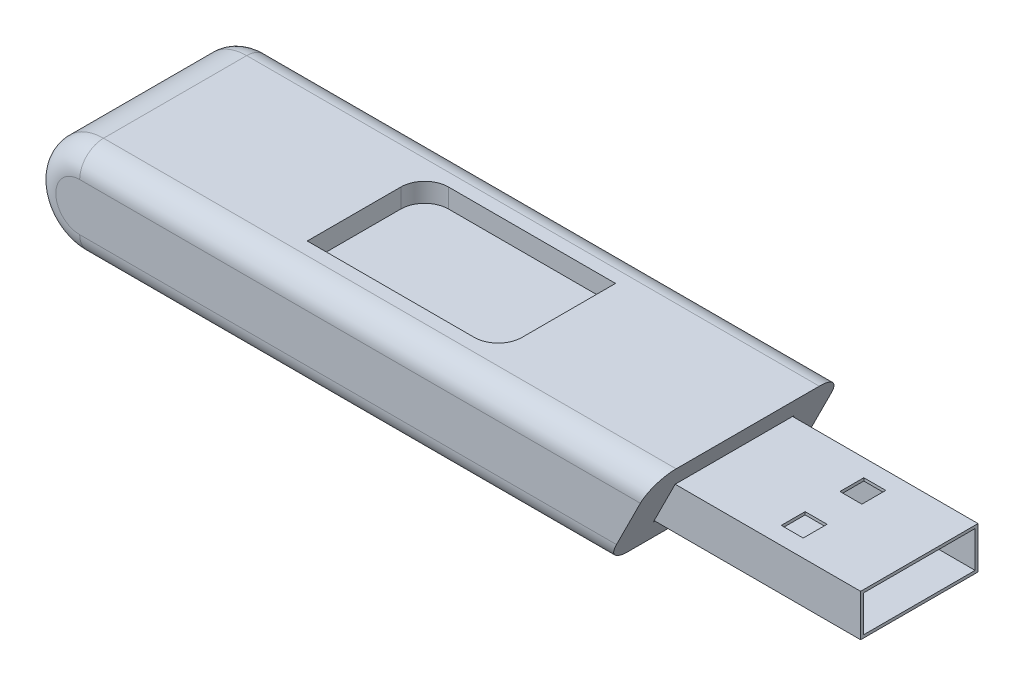
from build123d import *

# Parameters (mm, degrees)
BOSS_EXTRUDE1_DEPTH = 20
SKETCH2_W           = 12.5
SKETCH2_H           = 4.6
CUT_EXTRUDE1_DEPTH  = 60
SKETCH4_W           = 12.3
SKETCH4_H           = 4.4
SKETCH4_W_2         = 11.7
SKETCH4_H_2         = 3.8
BOSS_EXTRUDE3_DEPTH = 40
SKETCH6_W           = 2.3
SKETCH6_H           = 2.5
CUT_EXTRUDE8_DEPTH  = 0.3
CUT_EXTRUDE10_DEPTH = 2
FILLET1_R           = 2.5
FILLET2_R           = 2.5


with BuildPart() as part:
    # Sketch1 → Boss-Extrude1 (new body)
    with BuildSketch(Plane.XY):
        with BuildLine():
            Line((-27.982882883, 10), (32.017117117, 10))
            Line((32.017117117, 10), (27.017117117, 0))
            Line((27.017117117, 0), (-27.982882883, 0))
            ThreePointArc((-27.982882883, 0), (-32.982882883, 5), (-27.982882883, 10))
        make_face()
    extrude(amount=BOSS_EXTRUDE1_DEPTH)

    # Sketch2 → Cut-Extrude1 (cut)
    with BuildSketch(Plane(origin=(50, 0, 0), x_dir=(0, 0, -1), z_dir=(1, 0, 0))):
        with Locations((-10, 5)):
            Rectangle(SKETCH2_W, SKETCH2_H)
    extrude(amount=-CUT_EXTRUDE1_DEPTH, mode=Mode.SUBTRACT)

    # Sketch7 → Cut-Extrude10 (cut)
    with BuildSketch(Plane(origin=(0, 10, 0), x_dir=(1, 0, 0), z_dir=(0, 1, 0))):
        with BuildLine():
            Line((-5.482882883, -3.85), (12.017117117, -3.85))
            Line((12.017117117, -3.85), (12.017117117, -13.65))
            ThreePointArc((12.017117117, -13.65), (11.28488407, -15.417766953), (9.517117117, -16.15))
            Line((9.517117117, -16.15), (-7.982882883, -16.15))
            Line((-7.982882883, -16.15), (-7.982882883, -6.35))
            ThreePointArc((-7.982882883, -6.35), (-7.250649836, -4.582233047), (-5.482882883, -3.85))
        make_face()
    extrude(amount=-CUT_EXTRUDE10_DEPTH, mode=Mode.SUBTRACT)

    # Fillet1
    fillet1_edges = [part.edges().sort_by_distance(p)[0] for p in [
        (2.017117117, 10, 20),
        (-32.982882883, 5, 20),
        (-0.482882883, 0, 20),
    ]]
    fillet(fillet1_edges, radius=FILLET1_R)

    # Fillet2
    fillet2_edges = [part.edges().sort_by_distance(p)[0] for p in [
        (2.017117117, 10, 0),
        (-0.482882883, 0, 0),
        (-32.982882883, 5, 0),
    ]]
    fillet(fillet2_edges, radius=FILLET2_R)


with BuildPart() as body_2:
    # Sketch4 → Boss-Extrude3 (new body)
    with BuildSketch(Plane(origin=(50, 0, 0), x_dir=(0, 0, -1), z_dir=(1, 0, 0))):
        with Locations((-10, 5)):
            Rectangle(SKETCH4_W, SKETCH4_H)
        with Locations((-10, 5)):
            Rectangle(SKETCH4_W_2, SKETCH4_H_2, mode=Mode.SUBTRACT)
    extrude(amount=-BOSS_EXTRUDE3_DEPTH)

    # Sketch6 → Cut-Extrude8 (cut)
    with BuildSketch(Plane(origin=(0, 7.2, 0), x_dir=(1, 0, 0), z_dir=(0, 1, 0))):
        with Locations((41.008558559, -6.925)):
            Rectangle(SKETCH6_W, SKETCH6_H)
        with Locations((41.008558559, -13.075)):
            Rectangle(SKETCH6_W, SKETCH6_H)
    extrude(amount=-CUT_EXTRUDE8_DEPTH, mode=Mode.SUBTRACT)


solid = Compound([part.part, body_2.part])
